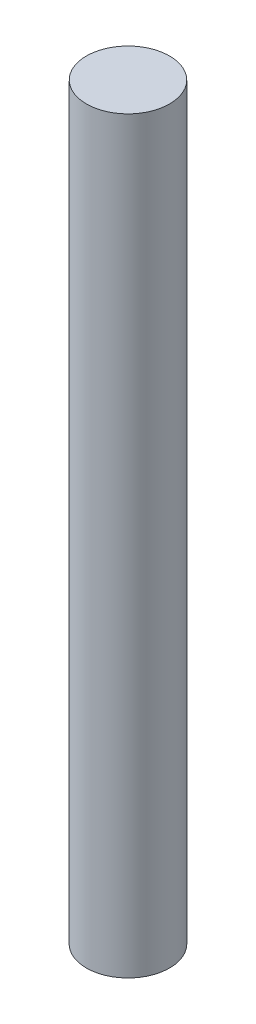
from build123d import *

# Parameters (mm, degrees)
SKETCH_2_R      = 2
EXTRUDE_1_DEPTH = 36


with BuildPart() as part:
    # 草图2 → 凸台-拉伸1 (new body)
    with BuildSketch(Plane(origin=(0, 0, 0), x_dir=(1, 0, 0), z_dir=(0, 1, 0))):
        with Locations(Location((0, 0, 0), (0, 0, 270))):
            Circle(SKETCH_2_R)
    extrude(amount=EXTRUDE_1_DEPTH)


solid = part.part
